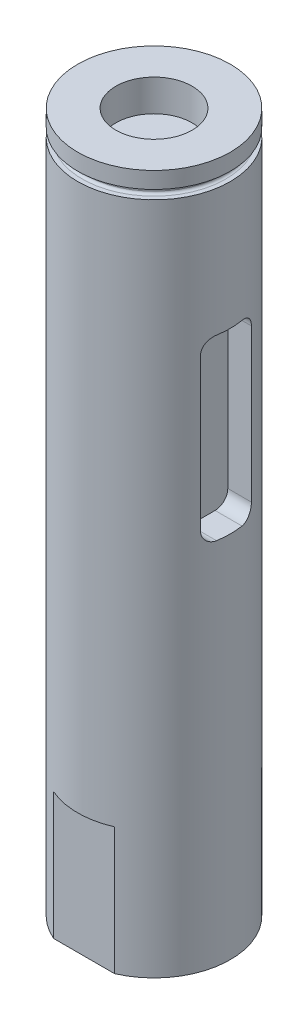
from build123d import *
from build123d.topology import SkipClean

# Parameters (mm, degrees)
BOSS_EXTRUDE1_DEPTH   = 14
SKETCH2_R             = 6
BOSS_EXTRUDE2_DEPTH   = 12
BOSS_EXTRUDE3_START   = 15
SKETCH3_R             = 6
BOSS_EXTRUDE3_DEPTH   = 15
CUT_EXTRUDE1_DEPTH    = 2.2
BOSS_EXTRUDE4_START   = 14
BOSS_EXTRUDE4_DEPTH   = 14
CUT_EXTRUDE2_DEPTH    = 10
SKETCH24_R            = 3
CUT_EXTRUDE3_DEPTH    = 2.5
M4_TAPPED_HOLE1_D     = 3.3
M4_TAPPED_HOLE1_DEPTH = 10
M4_TAPPED_HOLE1_TIP   = 0.991420021


with BuildPart() as part:
    # Sketch1 → Boss-Extrude1 (new body)
    with BuildSketch(Plane(origin=(0, 0, 0), x_dir=(1, 0, 0), z_dir=(0, 1, 0))):
        with BuildLine():
            ThreePointArc((5.656854249, 2), (-6, 0), (5.656854249, -2))
            ThreePointArc((5.656854249, -2), (6, 0), (5.656854249, 2))
        make_face()
    extrude(amount=BOSS_EXTRUDE1_DEPTH)

    # Sketch2 → Boss-Extrude2 (add)
    with BuildSketch(Plane(origin=(0, 14, 0), x_dir=(1, 0, 0), z_dir=(0, 1, 0))):
        with Locations(Location((0, 0, 0), (0, 0, 270))):
            Circle(SKETCH2_R)
    extrude(amount=BOSS_EXTRUDE2_DEPTH)

    # Sketch3 → Boss-Extrude3 (add)
    with BuildSketch(Plane.XZ.offset(BOSS_EXTRUDE3_START)):
        with Locations(Location((0, 0, 0), (0, 0, 270))):
            Circle(SKETCH3_R)
    extrude(amount=-BOSS_EXTRUDE3_DEPTH)

    # Groove Sketch → Retaining Ring Groove (revolve, cut)
    with BuildSketch(Plane(origin=(1.604252923, 12.182890291, 0.373259529), x_dir=(-0.9343262431877186, 0.2824476966643587, -0.2173885230174828), z_dir=(-0.2266157025474993, 0, 0.9739842521103221)), mode=Mode.PRIVATE) as retaining_ring_groove_sk:
        with BuildLine():
            Line((10.535414006, -9.946396708), (11.998320123, -9.51566397))
            Line((11.998320123, -9.51566397), (11.800606735, -8.84416608))
            Line((11.800606735, -8.84416608), (10.337700618, -9.274898818))
            ThreePointArc((10.337700618, -9.274898818), (10.21858296, -9.371036434), (10.202333617, -9.523244897))
            Line((10.202333617, -9.523244897), (10.287067926, -9.811029707))
            ThreePointArc((10.287067926, -9.811029707), (10.383205542, -9.930147365), (10.535414006, -9.946396708))
        make_face()
    revolve(retaining_ring_groove_sk.sketch.rotate(Axis((0, 60.224615576, 0), (0, -1, 0)), 76.902094509), axis=Axis((0, 60.224615576, 0), (0, -1, 0)), mode=Mode.SUBTRACT)

    # Sketch21 → Cut-Extrude1 (cut)
    with SkipClean():  # the faces are left unmerged after this step: merging them gives an invalid solid
        with BuildSketch(Plane(origin=(6, 0, 0), x_dir=(0, 0, -1), z_dir=(1, 0, 0))):
            with BuildLine():
                Line((-1, 14), (1, 14))
                ThreePointArc((1, 14), (1.707106781, 13.707106781), (2, 13))
                Line((2, 13), (2, 1))
                ThreePointArc((2, 1), (1.707106781, 0.292893219), (1, 0))
                Line((1, 0), (-1, 0))
                ThreePointArc((-1, 0), (-1.707106781, 0.292893219), (-2, 1))
                Line((-2, 1), (-2, 13))
                ThreePointArc((-2, 13), (-1.707106781, 13.707106781), (-1, 14))
            make_face()
        extrude(amount=-CUT_EXTRUDE1_DEPTH, mode=Mode.SUBTRACT)

    # Sketch22 → Boss-Extrude4 (add)
    with SkipClean():  # the faces are left unmerged after this step: merging them gives an invalid solid
        with BuildSketch(Plane.XZ.offset(15).offset(BOSS_EXTRUDE4_START)):
            with BuildLine():
                ThreePointArc((2.397915762, -5.5), (0, 6), (-2.397915762, -5.5))
                ThreePointArc((-2.397915762, -5.5), (0, -6), (2.397915762, -5.5))
            make_face()
        extrude(amount=-BOSS_EXTRUDE4_DEPTH)

    # Sketch23 → Cut-Extrude2 (cut)
    with SkipClean():  # the faces are left unmerged after this step: merging them gives an invalid solid
        with BuildSketch(Plane.XZ.offset(29)):
            with BuildLine():
                Line((-2.397915762, 5.5), (2.397915762, 5.5))
                ThreePointArc((2.397915762, 5.5), (0, 6), (-2.397915762, 5.5))
            make_face()
        extrude(amount=-CUT_EXTRUDE2_DEPTH, mode=Mode.SUBTRACT)

    # Sketch24 → Cut-Extrude3 (cut)
    with SkipClean():  # the faces are left unmerged after this step: merging them gives an invalid solid
        with BuildSketch(Plane(origin=(0, 26, 0), x_dir=(1, 0, 0), z_dir=(0, 1, 0))):
            with Locations(Location((0, 0, 0), (0, 0, 270))):
                Circle(SKETCH24_R)
        extrude(amount=-CUT_EXTRUDE3_DEPTH, mode=Mode.SUBTRACT)

    # M4 Tapped Hole1
    with Locations(Plane(origin=(0, -29, 0), x_dir=(-1, 0, 0), z_dir=(0, -1, 0))):
        with Locations((0, 0)):
            Hole(M4_TAPPED_HOLE1_D / 2, depth=M4_TAPPED_HOLE1_DEPTH)
            with Locations((0, 0, -(M4_TAPPED_HOLE1_DEPTH + M4_TAPPED_HOLE1_TIP / 2))):  # 118° drill point
                Cone(0, M4_TAPPED_HOLE1_D / 2, M4_TAPPED_HOLE1_TIP, mode=Mode.SUBTRACT)


solid = part.part
